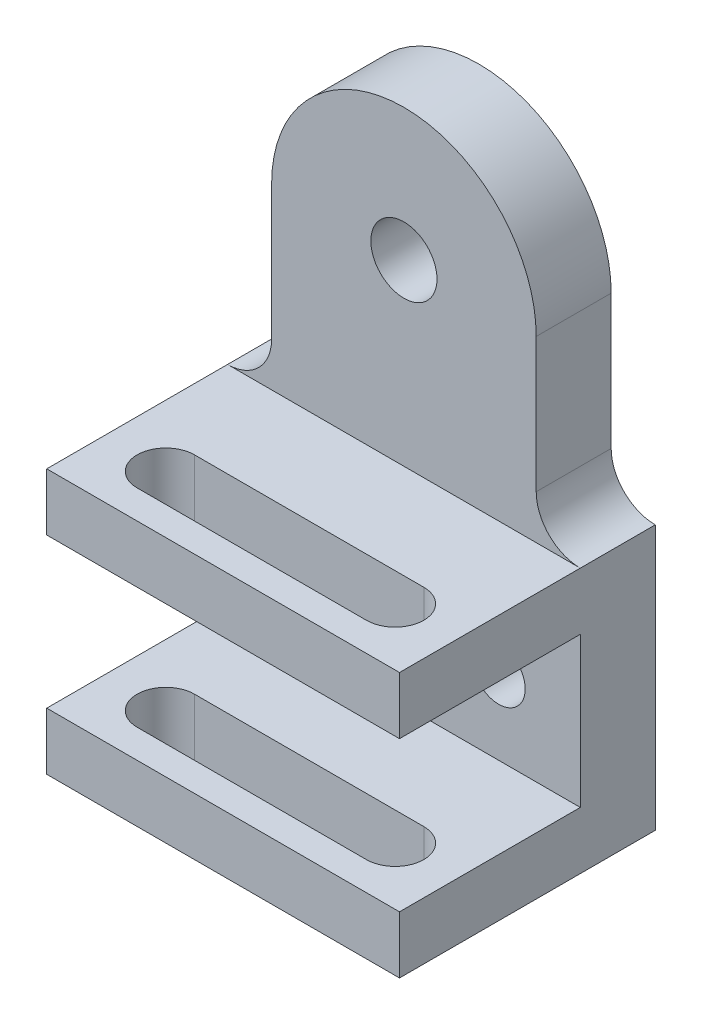
from build123d import *

# Parameters (mm, degrees)
BOSS_EXTRUDE1_DEPTH = 431.8
SKETCH2_R           = 152.4
SKETCH2_R_2         = 190.5
CUT_EXTRUDE1_DEPTH  = 431.8
SKETCH3_W           = 2032
SKETCH3_H           = 330.2
BOSS_EXTRUDE2_DEPTH = 1041.4
CUT_EXTRUDE2_DEPTH  = 3084.171861898


with BuildPart() as part:
    # Sketch1 → Boss-Extrude1 (new body)
    with BuildSketch(Plane.XY):
        with BuildLine():
            Line((0, 0), (2032, 0))
            Line((2032, 0), (2032, 1524))
            ThreePointArc((2032, 1524), (1852.394877579, 1598.394877579), (1778, 1778))
            Line((1778, 1778), (1778, 2552.7))
            ThreePointArc((1778, 2552.7), (1016, 3314.7), (254, 2552.7))
            Line((254, 2552.7), (254, 1778))
            ThreePointArc((254, 1778), (179.605122421, 1598.394877579), (0, 1524))
            Line((0, 1524), (0, 0))
        make_face()
    extrude(amount=BOSS_EXTRUDE1_DEPTH)

    # Sketch2 → Cut-Extrude1 (cut)
    with BuildSketch(Plane.XY.offset(431.8)):
        with Locations((469.9, 762)):
            Circle(SKETCH2_R)
        with Locations((1562.1, 762)):
            Circle(SKETCH2_R)
        with Locations((1016, 2552.7)):
            Circle(SKETCH2_R_2)
    extrude(amount=-CUT_EXTRUDE1_DEPTH, mode=Mode.SUBTRACT)

    # Sketch3 → Boss-Extrude2 (add)
    with BuildSketch(Plane.XY.offset(431.8)):
        with Locations((1016, 165.1)):
            Rectangle(SKETCH3_W, SKETCH3_H)
        with Locations((1016, 1358.9)):
            Rectangle(SKETCH3_W, SKETCH3_H)
    extrude(amount=BOSS_EXTRUDE2_DEPTH)

    # Sketch4 → Cut-Extrude2 (cut, through all)
    with BuildSketch(Plane(origin=(0, 1524, 0), x_dir=(1, 0, 0), z_dir=(0, 1, 0))):
        with BuildLine():
            Line((355.6, -977.9), (1676.4, -977.9))
            ThreePointArc((1676.4, -977.9), (1841.5, -1143), (1676.4, -1308.1))
            Line((1676.4, -1308.1), (355.6, -1308.1))
            ThreePointArc((355.6, -1308.1), (190.5, -1143), (355.6, -977.9))
        make_face()
    extrude(amount=-CUT_EXTRUDE2_DEPTH, mode=Mode.SUBTRACT)


solid = part.part
